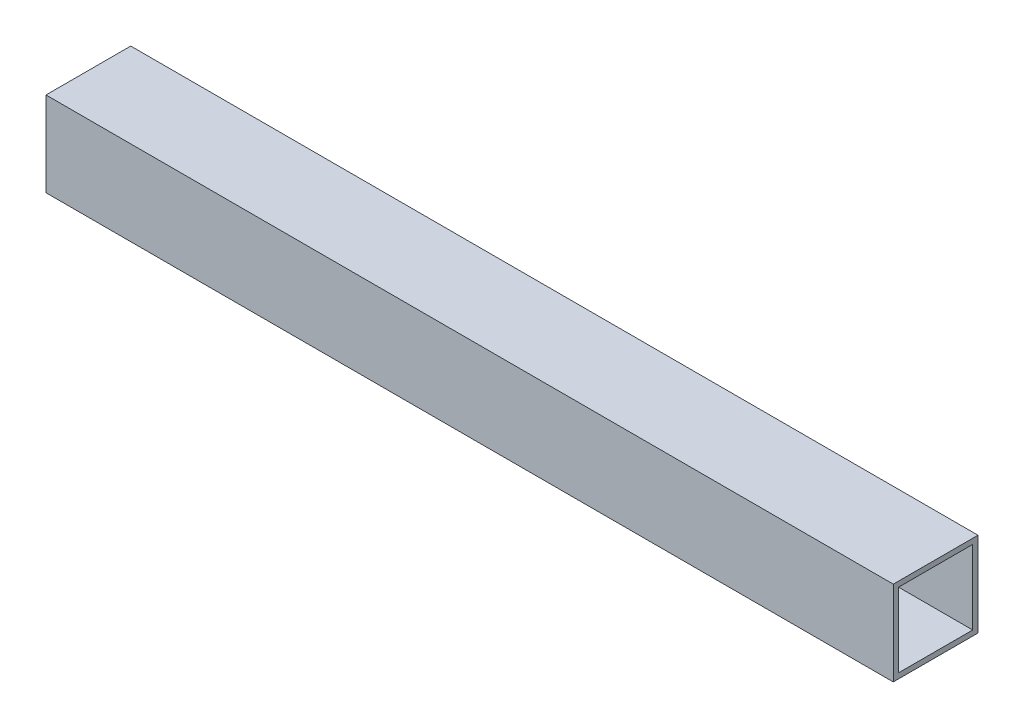
from build123d import *

# Parameters (mm, degrees)
SKETCH1_W           = 25.4
SKETCH1_H           = 25.4
SKETCH1_W_2         = 22.225
SKETCH1_H_2         = 22.225
EXTRUDE_THIN1_DEPTH = 254


with BuildPart() as part:
    # Sketch1 → Extrude-Thin1 (new body)
    with BuildSketch(Plane(origin=(0, 0, 0), x_dir=(0, 0, -1), z_dir=(1, 0, 0))):
        Rectangle(SKETCH1_W, SKETCH1_H)
        Rectangle(SKETCH1_W_2, SKETCH1_H_2, mode=Mode.SUBTRACT)
    extrude(amount=EXTRUDE_THIN1_DEPTH)


solid = part.part
